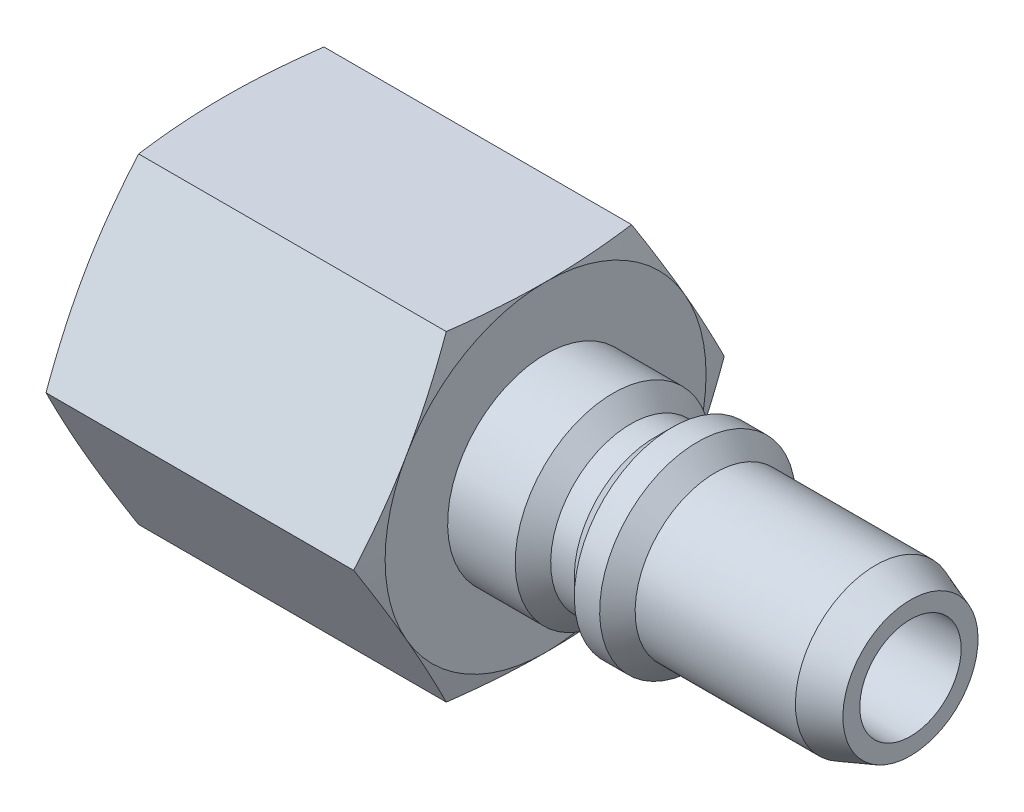
from build123d import *

# Parameters (mm, degrees)
SKETCH2_R           = 3
BOSS_EXTRUDE1_DEPTH = 40.6


with BuildPart() as part:
    # Sketch2 → Boss-Extrude1 (new body)
    with BuildSketch(Plane(origin=(0, 0, 0), x_dir=(0, 0, -1), z_dir=(1, 0, 0))):
        Polygon((10.969655115, 0), (5.484827557, 9.5), (-5.484827557, 9.5), (-10.969655115, 0), (-5.484827557, -9.5), (5.484827557, -9.5), align=None)
        Circle(SKETCH2_R, mode=Mode.SUBTRACT)
    extrude(amount=-BOSS_EXTRUDE1_DEPTH)

    # Sketch3 → Cut-Revolve1 (revolve, cut)
    with BuildSketch(Plane.XY, mode=Mode.PRIVATE) as cut_revolve1_sk:
        Polygon((-21.6, 9.5), (-21.6, 5.8), (-17.6, 5.8), (-16.55, 4.75), (-15.15, 4.75), (-14.1, 5.8), (-12.6, 5.8), (-11.55, 4.75), (-2.060608065, 4.75), (0, 4), (0, 12), (-22.269872981, 12), align=None)
        Polygon((-40.6, 9.5), (-40.6, 13), (-39.662177826, 13), align=None)
    revolve(cut_revolve1_sk.sketch.rotate(Axis((-40.6, 0, 0), (1, 0, 0)), 180), axis=Axis((-40.6, 0, 0), (1, 0, 0)), mode=Mode.SUBTRACT)

    # Sketch6 → 1/4 NPT Tapped Hole1 (revolve, cut)
    with BuildSketch(Plane(origin=(-40.6, 0, 0), x_dir=(0, 0, 1), z_dir=(0, 1, 0))):
        Polygon((0, 0), (0, 14.2), (5.5626, 14.2), (5.5626, 12), (6.56760783, 12), (6.9172709, 0.3217291), (7.239, 0), align=None)
    revolve(axis=Axis((-46.95, 0, 0), (1, 0, 0)), mode=Mode.SUBTRACT)


solid = part.part
